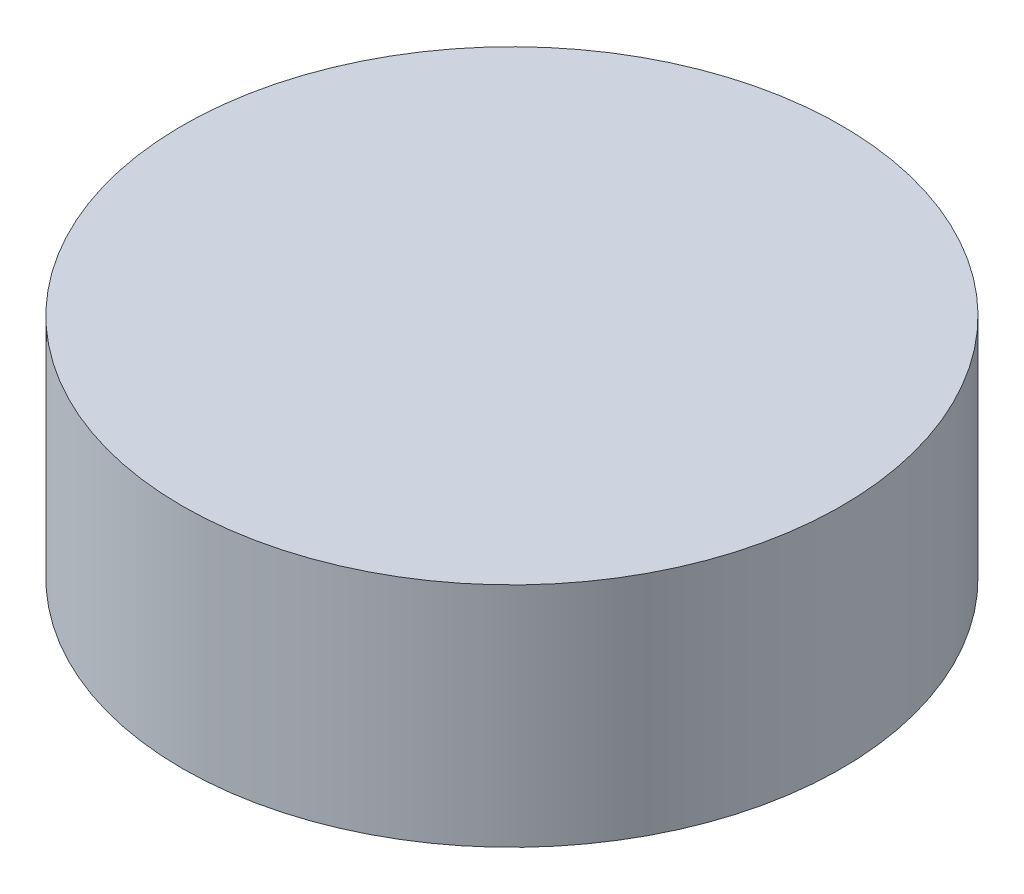
from build123d import *

# Parameters (mm, degrees)
SKETCH1_R           = 36.83
BOSS_EXTRUDE1_DEPTH = 25.4


with BuildPart() as part:
    # Sketch1 → Boss-Extrude1 (new body)
    with BuildSketch(Plane(origin=(0, 0, 0), x_dir=(1, 0, 0), z_dir=(0, 1, 0))):
        Circle(SKETCH1_R)
    extrude(amount=BOSS_EXTRUDE1_DEPTH)


solid = part.part
